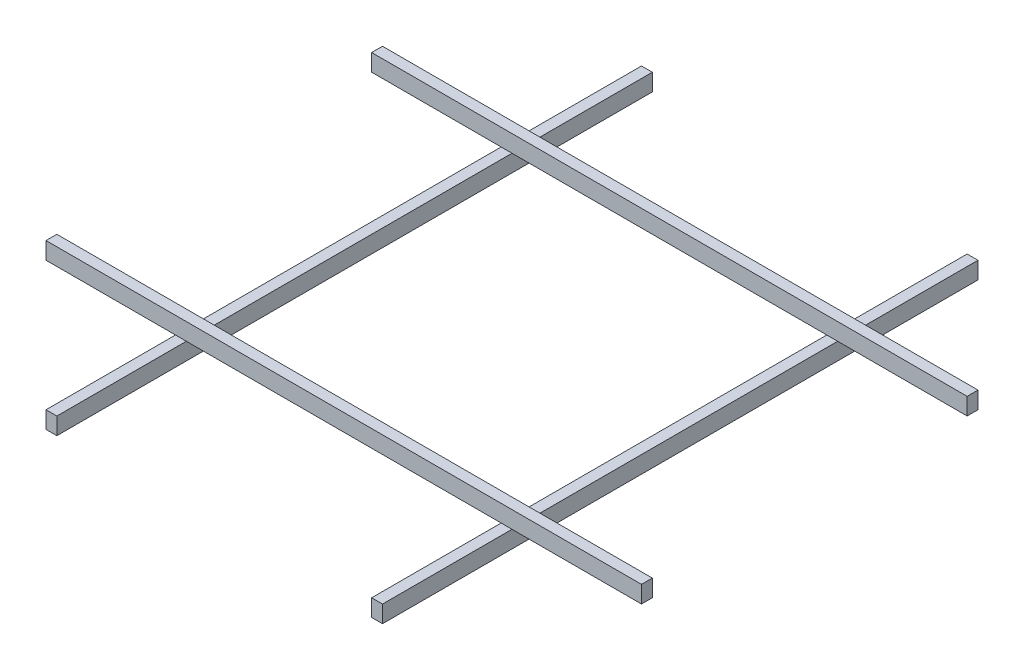
from build123d import *

# Parameters (mm, degrees)
SKETCH1_W              = 88.9
SKETCH1_H              = 139.7
PROFILES_4X6_1_DEPTH   = 4876.8
SKETCH1_ON_SEGMENT_2_W = 88.9
SKETCH1_ON_SEGMENT_2_H = 139.7
PROFILES_4X6_1_2_DEPTH = 4876.8
SKETCH1_ON_SEGMENT_3_W = 88.9
SKETCH1_ON_SEGMENT_3_H = 139.7
PROFILES_4X6_1_3_DEPTH = 4876.8
SKETCH1_ON_SEGMENT_4_W = 88.9
SKETCH1_ON_SEGMENT_4_H = 139.7
PROFILES_4X6_1_4_DEPTH = 4876.8


with BuildPart() as part:
    # Sketch1 → Profiles 4X6(1) (new body)
    with BuildSketch(Plane(origin=(800.1, 0, 0), x_dir=(-1, 0, 0), z_dir=(0, 0, -1))):
        Rectangle(SKETCH1_W, SKETCH1_H)
    extrude(amount=PROFILES_4X6_1_DEPTH)


with BuildPart() as body_2:
    # Sketch1 on segment 2 (carried to segment 2) → Profiles 4X6_1 2 (new body)
    with BuildSketch(Plane(origin=(3467.1, 0, 0), x_dir=(-1, 0, 0), z_dir=(0, 0, -1))):
        Rectangle(SKETCH1_ON_SEGMENT_2_W, SKETCH1_ON_SEGMENT_2_H)
    extrude(amount=PROFILES_4X6_1_2_DEPTH)


with BuildPart() as body_3:
    # Sketch1 on segment 3 (carried to segment 3) → Profiles 4X6_1 3 (new body)
    with BuildSketch(Plane(origin=(-304.8, 139.7, -3771.9), x_dir=(0, 0, -1), z_dir=(1, 0, 0))):
        Rectangle(SKETCH1_ON_SEGMENT_3_W, SKETCH1_ON_SEGMENT_3_H)
    extrude(amount=PROFILES_4X6_1_3_DEPTH)


with BuildPart() as body_4:
    # Sketch1 on segment 4 (carried to segment 4) → Profiles 4X6_1 4 (new body)
    with BuildSketch(Plane(origin=(4572, 139.7, -1104.9), x_dir=(0, 0, 1), z_dir=(-1, 0, 0))):
        Rectangle(SKETCH1_ON_SEGMENT_4_W, SKETCH1_ON_SEGMENT_4_H)
    extrude(amount=PROFILES_4X6_1_4_DEPTH)


solid = Compound([part.part, body_2.part, body_3.part, body_4.part])
